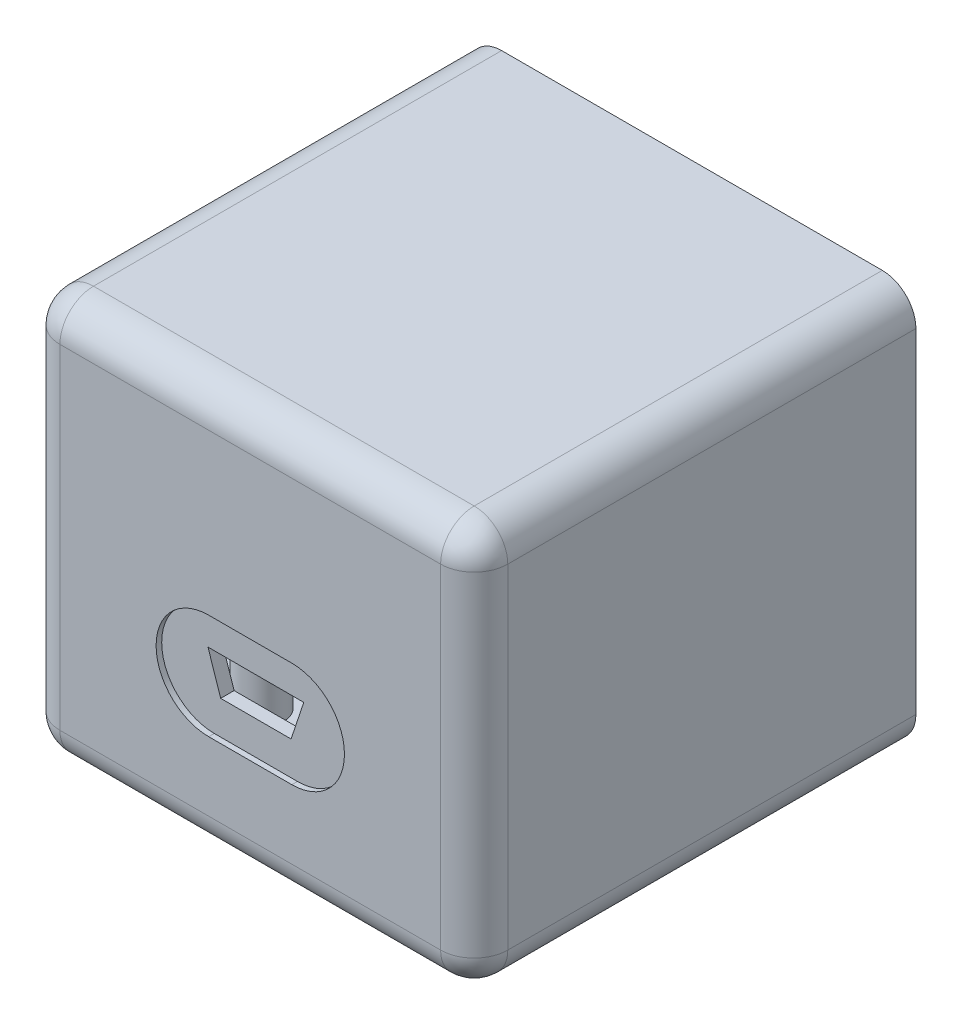
from build123d import *

# Parameters (mm, degrees)
ESQUISSE1_W             = 40
ESQUISSE1_H             = 35.851343862
ESQUISSE1_W_2           = 32.14
ESQUISSE1_H_2           = 28.42
BOSS_EXTRU_1_DEPTH      = 39.45
ESQUISSE6_R             = 2
BOSS_EXTRU_7_DEPTH      = 7.5
ESQUISSE3_W             = 40
ESQUISSE3_H             = 35.851343862
BOSS_EXTRU_5_DEPTH      = 1.7
ENL_V_MAT_EXTRU_1_DEPTH = 0.5
ESQUISSE8_R             = 1.1
BOSS_EXTRU_8_DEPTH      = 2
CONG_1_R                = 3


with BuildPart() as part:
    # Esquisse1 → Boss.-Extru.1 (new body)
    with BuildSketch(Plane.XY):
        with Locations((0, 0.015671931)):
            Rectangle(ESQUISSE1_W, ESQUISSE1_H)
        Rectangle(ESQUISSE1_W_2, ESQUISSE1_H_2, mode=Mode.SUBTRACT)
    extrude(amount=BOSS_EXTRU_1_DEPTH)

    # Esquisse6 → Boss.-Extru.7 (add)
    with BuildSketch(Plane(origin=(0, -14.21, 0), x_dir=(1, 0, 0), z_dir=(0, 1, 0))):
        with Locations(Location((-9, -15.45, 0), (0, 0, 180))):
            Circle(ESQUISSE6_R)
        with Locations(Location((9, -15.45, 0), (0, 0, 180))):
            Circle(ESQUISSE6_R)
        with Locations(Location((-9, -29.45, 0), (0, 0, 180))):
            Circle(ESQUISSE6_R)
        with Locations(Location((9, -29.45, 0), (0, 0, 180))):
            Circle(ESQUISSE6_R)
    extrude(amount=BOSS_EXTRU_7_DEPTH)

    # Esquisse3 → Boss.-Extru.5 (add)
    with BuildSketch(Plane.XY.offset(39.45)):
        with Locations((0, 0.015671931)):
            Rectangle(ESQUISSE3_W, ESQUISSE3_H)
        Polygon((-3.144151844, -5.76), (3.144151844, -5.76), (4.277485177, -2.36), (-4.277485177, -2.36), align=None, mode=Mode.SUBTRACT)
    extrude(amount=-BOSS_EXTRU_5_DEPTH)

    # Esquisse4 → Enlèv. mat.-Extru.1 (cut)
    with BuildSketch(Plane.XY.offset(39.45)):
        with BuildLine():
            Line((-3.710818511, 0.64), (3.710818511, 0.64))
            ThreePointArc((3.710818511, 0.64), (8.410818511, -4.06), (3.710818511, -8.76))
            Line((3.710818511, -8.76), (-3.710818511, -8.76))
            ThreePointArc((-3.710818511, -8.76), (-8.410818511, -4.06), (-3.710818511, 0.64))
        make_face()
    extrude(amount=-ENL_V_MAT_EXTRU_1_DEPTH, mode=Mode.SUBTRACT)

    # Esquisse8 → Boss.-Extru.8 (add)
    # profile 1 of 2: a face of its own
    with BuildSketch(Plane(origin=(0, 0, 1.2), x_dir=(-1, 0, 0), z_dir=(0, 0, -1))):
        with BuildLine():
            Line((16.07, -10.378743894), (16.07, -14.21))
            Line((16.07, -14.21), (10.268662175, -14.21))
            Line((10.268662175, -14.21), (10.268662175, -11.778743894))
            ThreePointArc((10.268662175, -11.778743894), (10.678712682, -10.7887944), (11.668662175, -10.378743894))
            Line((11.668662175, -10.378743894), (16.07, -10.378743894))
        make_face()
        with Locations((11.668662175, -11.778743894)):
            Circle(ESQUISSE8_R, mode=Mode.SUBTRACT)
    # profile 2 of 2: a face of its own
    with BuildSketch(Plane(origin=(0, 0, 1.2), x_dir=(-1, 0, 0), z_dir=(0, 0, -1))):
        with BuildLine():
            Line((-16.07, 14.21), (-9.868662175, 14.21))
            Line((-9.868662175, 14.21), (-9.868662175, 11.778743894))
            ThreePointArc((-9.868662175, 11.778743894), (-10.395869969, 10.505951688), (-11.668662175, 9.978743894))
            Line((-11.668662175, 9.978743894), (-16.07, 9.978743894))
            Line((-16.07, 9.978743894), (-16.07, 14.21))
        make_face()
        with Locations((-11.668662175, 11.778743894)):
            Circle(ESQUISSE8_R, mode=Mode.SUBTRACT)
    extrude(amount=-BOSS_EXTRU_8_DEPTH)

    # Congé1
    cong_1_edges = [part.edges().sort_by_distance(p)[0] for p in [
        (0, -17.91, 39.45),
        (-20, -17.91, 19.725),
        (20, 0.015671931, 39.45),
        (20, -17.91, 19.725),
        (0, 17.941343862, 39.45),
        (20, 17.941343862, 19.725),
        (-20, 0.015671931, 39.45),
        (-20, 17.941343862, 19.725),
    ]]
    fillet(cong_1_edges, radius=CONG_1_R)


solid = part.part
